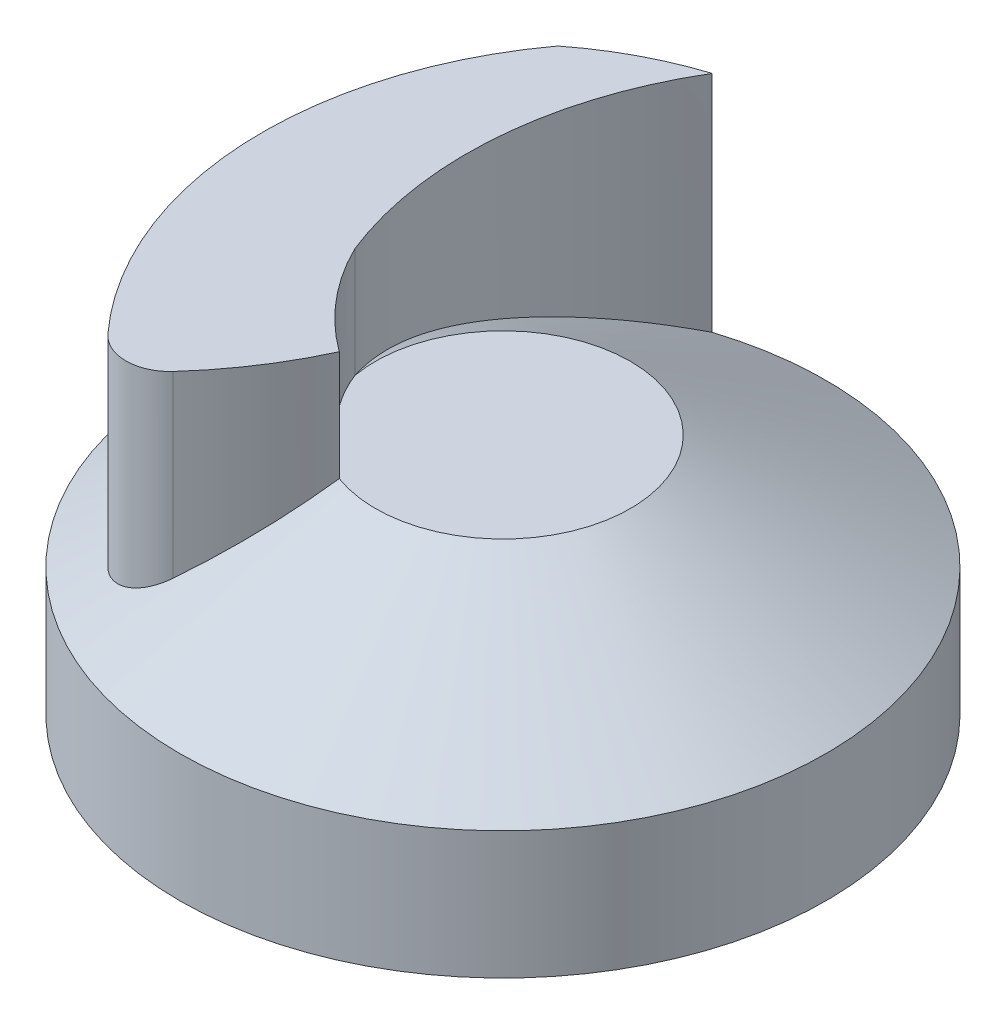
from build123d import *

# Parameters (mm, degrees)
EXTRUDE_1_REACH = 133.166


with BuildPart() as part:
    # Эскиз1 → Повернуть1 (revolve)
    with BuildSketch(Plane.XY, mode=Mode.PRIVATE) as revolve_1_sk:
        Polygon((0, 0), (-73.5, 0), (-73.5, 29), (-29, 55), (0, 55), align=None)
    revolve(revolve_1_sk.sketch.rotate(Axis((0, 0, 0), (0, -1, 0)), 270), axis=Axis((0, 0, 0), (0, -1, 0)))

    # Бобышка-Вытянуть1: up to this cone (the profile starts outside it)
    extrude_1_end = Plane(origin=(0, 80, 0), z_dir=(0, -1, 0)).offset(8.056180775) * Cone(1.712e-06, 214.986038462, 125.609819225, align=(Align.CENTER, Align.CENTER, Align.MIN), mode=Mode.PRIVATE)
    # Эскиз2 → Бобышка-Вытянуть1 (add, up to the surface)
    with BuildSketch(Plane(origin=(0, 80, 0), x_dir=(-1, 0, 0), z_dir=(0, -1, 0)), mode=Mode.PRIVATE) as extrude_1_sk1:
        with BuildLine():
            ThreePointArc((39.826891471, -50.018998092), (61.845069439, 2.908427791), (45.380271287, 57.817652822))
            ThreePointArc((45.380271287, 57.817652822), (34.438558368, 64.93254729), (22.410934831, 70))
            ThreePointArc((22.410934831, 70), (34.25441727, 33.17194105), (28.549688681, -5.090704886))
            ThreePointArc((28.549688681, -5.090704886), (20.626062909, -17.288589905), (10, -27.221315178))
            ThreePointArc((10, -27.221315178), (16.632121962, -39.182164271), (25, -50))
            ThreePointArc((25, -50), (32.409231762, -53.29825711), (39.826891471, -50.018998092))
        make_face()
    extrude_1_tool1 = extrude(extrude_1_sk1.sketch, amount=EXTRUDE_1_REACH, mode=Mode.PRIVATE) - extrude_1_end
    add(extrude_1_tool1.solids().sort_by_distance((-40.446865, 80, -0.64775))[0])


solid = part.part
